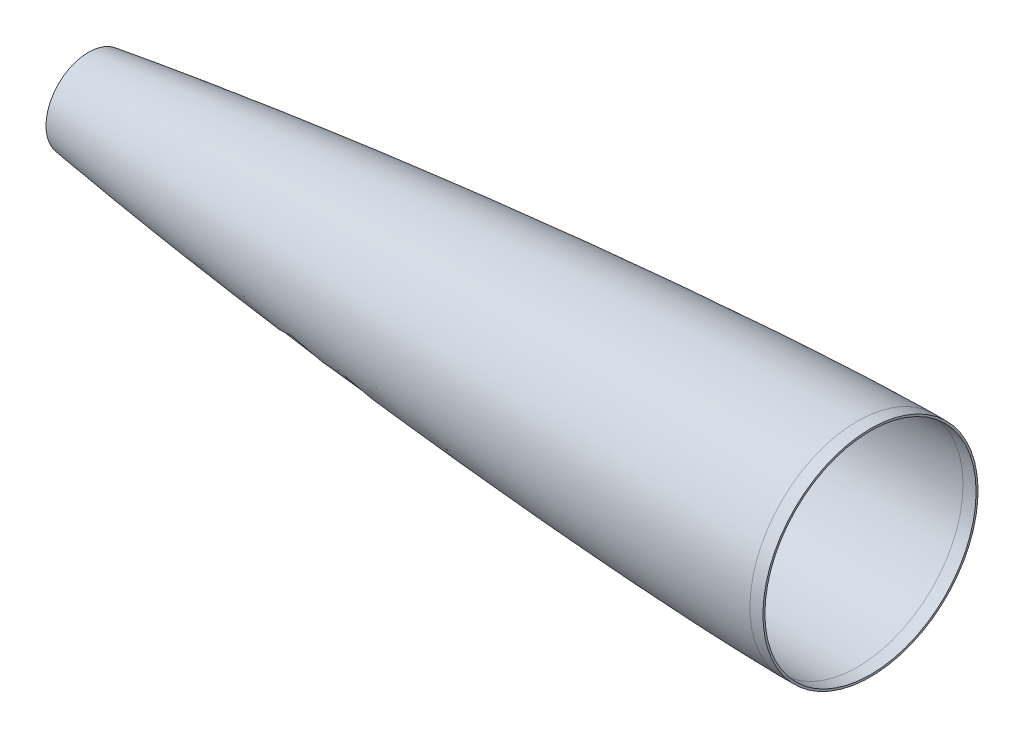
from build123d import *

# Parameters (mm, degrees)
SKETCH8_R           = 83.841254666
SKETCH8_R_2         = 82.317249201
BOSS_EXTRUDE1_DEPTH = 10.16
SKETCH9_R           = 78.358924529
CUT_EXTRUDE1_DEPTH  = 187.96


with BuildPart() as part:
    # Sketch7 → Revolve3 (revolve)
    with BuildSketch(Plane.XY):
        with BuildLine():
            add(Edge.make_bspline(
                [(2.890004562, 0), (2.895382745, 0.002478586), (3.114731574, 0.103470328), (3.772189671, 0.394557939), (4.892593468, 0.849688542), (6.72155052, 1.53547194), (9.051268741, 2.333090251), (12.826018708, 3.522776414), (17.599278058, 4.890957749), (23.373563661, 6.413247874), (29.176516141, 7.846136382), (36.94300293, 9.663971784), (46.689062936, 11.798346486), (58.424874502, 14.197738172), (70.188922239, 16.473591194), (81.974602451, 18.6463018), (97.71264621, 21.42647714), (117.420654598, 24.716507147), (141.110859364, 28.429826036), (164.833348495, 31.946353837), (188.581698126, 35.293998221), (212.351621104, 38.492682711), (244.069560818, 42.577741353), (283.757517922, 47.375416088), (331.434490554, 52.701690304), (379.154862581, 57.632899759), (426.912731664, 62.191265335), (490.634576058, 67.782687664), (554.417145386, 72.64929345), (618.252364776, 76.709424177), (658.17025028, 78.866656722), (690.115671587, 80.31586406), (714.080440133, 81.240229409), (734.052133379, 81.850150654), (750.032605884, 82.191005794), (758.010055581, 82.306548561), (762, 82.317249201)],
                knots=[0.003470978, 0.003470978, 0.003470978, 0.003470978, 0.00349552, 0.004471529, 0.006423545, 0.008375562, 0.012279595, 0.016183628, 0.023991695, 0.031799761, 0.039607828, 0.047415894, 0.063032027, 0.07864816, 0.094264293, 0.109880426, 0.125496558, 0.156728824, 0.18796109, 0.219193356, 0.250425621, 0.281657887, 0.312890153, 0.375354685, 0.437819216, 0.500283748, 0.562748279, 0.625212811, 0.750141874, 0.812606405, 0.875070937, 0.906303203, 0.937535468, 0.968767734, 0.984383867, 0.999994686, 0.999994686, 0.999994686, 0.999994686], degree=3))
            Line((762, 82.317249201), (762, 83.841254666))
            add(Edge.make_bspline(
                [(0, 0), (0.002469036, 0.007698152), (0.00852038, 0.022545642), (0.025428785, 0.049911406), (0.065694849, 0.100096678), (0.127523873, 0.163176144), (0.212062429, 0.237272493), (0.332279694, 0.331578396), (0.47681638, 0.434147846), (0.646496772, 0.544815952), (0.841412681, 0.663024364), (1.126864222, 0.82633392), (1.572744504, 1.062892156), (2.33539055, 1.432268664), (3.710931738, 2.02979685), (6.154578127, 2.969838304), (10.668005752, 4.490267325), (18.999517068, 6.917303838), (33.385795617, 10.520869917), (58.214680344, 15.881727226), (92.501407111, 22.236378549), (134.347160824, 29.066892837), (181.232321928, 35.913847395), (228.199436648, 42.167572329), (275.229416109, 47.928683924), (322.309575865, 53.261898342), (369.432294544, 58.204857708), (416.591925172, 62.781349507), (463.784734462, 67.002125548), (511.007900045, 70.868414522), (558.259527802, 74.370378395), (605.538293137, 77.485800464), (646.930327879, 79.837294836), (682.425589554, 81.539197971), (710.863439026, 82.65535626), (729.852911101, 83.259007577), (745.309411706, 83.632760833), (754.846503834, 83.785926018), (759.61543609, 83.834878653), (762, 83.841254666)],
                knots=[0, 0, 0, 0, 0, 4.177e-05, 8.3539e-05, 0.000167079, 0.000334158, 0.000501236, 0.000668315, 0.000962463, 0.001256611, 0.001555846, 0.001855081, 0.002674694, 0.003884179, 0.005967022, 0.009661666, 0.016303633, 0.028675652, 0.051140007, 0.0868676, 0.148543873, 0.210220157, 0.271896443, 0.333572727, 0.395249011, 0.456925295, 0.518601581, 0.580277867, 0.641954151, 0.703630435, 0.765306721, 0.826983006, 0.888659291, 0.919497433, 0.950335576, 0.975167788, 0.987583894, 1, 1, 1, 1, 1], degree=4))
            Line((0, 0), (2.890004562, 0))
        make_face()
    revolve(axis=Axis((0, 0, 0), (1, 0, 0)))

    # Sketch8 → Boss-Extrude1 (add)
    with BuildSketch(Plane(origin=(762, 0, 0), x_dir=(0, 0, -1), z_dir=(1, 0, 0))):
        with Locations(Location((0, 0, 0), (0, 0, 90))):
            Circle(SKETCH8_R)
        with Locations(Location((0, 0, 0), (0, 0, 270))):
            Circle(SKETCH8_R_2, mode=Mode.SUBTRACT)
    extrude(amount=BOSS_EXTRUDE1_DEPTH)

    # Sketch9 → Cut-Extrude1 (cut)
    with BuildSketch(Plane(origin=(162.56, 0, 0), x_dir=(0, 0, -1), z_dir=(1, 0, 0))):
        Circle(SKETCH9_R)
    extrude(amount=-CUT_EXTRUDE1_DEPTH, mode=Mode.SUBTRACT)


solid = part.part
